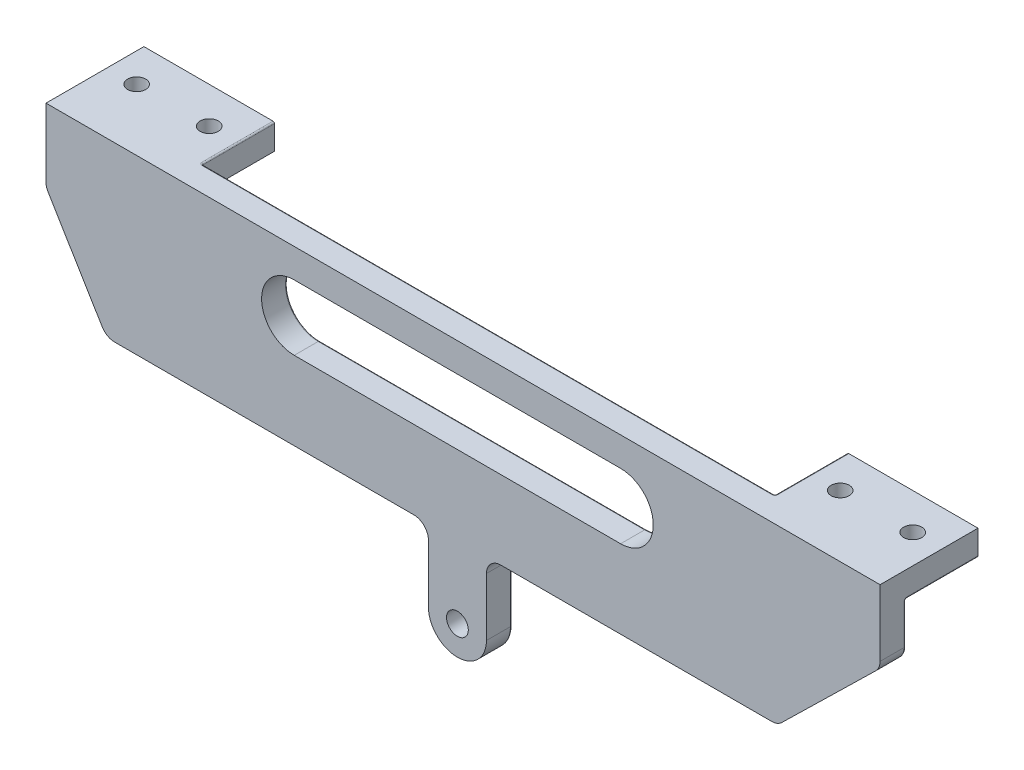
from build123d import *

# Parameters (mm, degrees)
SKETCH5_R           = 1.5
BOSS_EXTRUDE1_DEPTH = 3.5
SKETCH6_W           = 18
SKETCH6_H           = 10
SKETCH6_R           = 1.25
BOSS_EXTRUDE2_DEPTH = 3.5
FILLET1_R           = 2
FILLET2_R           = 0.2


with BuildPart() as part:
    # Sketch5 → Boss-Extrude1 (new body)
    with BuildSketch(Plane.XY):
        with BuildLine():
            Line((52.244364221, 93.802541786), (-62.755635779, 93.802541786))
            Line((-62.755635779, 93.802541786), (-62.755635779, 83.802541786))
            Line((-62.755635779, 83.802541786), (-54.423503372, 70))
            Line((-54.423503372, 70), (-10.03072393, 70))
            Line((-10.03072393, 70), (-10.03072393, 60))
            ThreePointArc((-10.03072393, 60), (-6.03072393, 56), (-2.03072393, 60))
            Line((-2.03072393, 60), (-2.03072393, 70))
            Line((-2.03072393, 70), (38.111411694, 70))
            Line((38.111411694, 70), (52.244364221, 83.802541786))
            Line((52.244364221, 83.802541786), (52.244364221, 93.802541786))
        make_face()
        with Locations((-6.03072393, 60)):
            Circle(SKETCH5_R, mode=Mode.SUBTRACT)
        with BuildLine():
            Line((16.46927607, 89.802541786), (-28.53072393, 89.802541786))
            ThreePointArc((-28.53072393, 89.802541786), (-33.03072393, 85.302541786), (-28.53072393, 80.802541786))
            Line((-28.53072393, 80.802541786), (16.46927607, 80.802541786))
            ThreePointArc((16.46927607, 80.802541786), (20.96927607, 85.302541786), (16.46927607, 89.802541786))
        make_face(mode=Mode.SUBTRACT)
    extrude(amount=BOSS_EXTRUDE1_DEPTH)

    # Sketch6 → Boss-Extrude2 (add)
    # profile 1 of 2: a face of its own
    with BuildSketch(Plane(origin=(0, 93.802541786, 0), x_dir=(1, 0, 0), z_dir=(0, 1, 0))):
        with Locations((-53.755635779, 5)):
            Rectangle(SKETCH6_W, SKETCH6_H)
        with Locations(Location((-58.755635779, 5, 0), (0, 0, 180))):
            Circle(SKETCH6_R, mode=Mode.SUBTRACT)
        with Locations(Location((-48.755635779, 5, 0), (0, 0, 180))):
            Circle(SKETCH6_R, mode=Mode.SUBTRACT)
    # profile 2 of 2: a face of its own
    with BuildSketch(Plane(origin=(0, 93.802541786, 0), x_dir=(1, 0, 0), z_dir=(0, 1, 0))):
        with Locations((43.244364221, 5)):
            Rectangle(SKETCH6_W, SKETCH6_H)
        with Locations((38.244364221, 5)):
            Circle(SKETCH6_R, mode=Mode.SUBTRACT)
        with Locations((48.244364221, 5)):
            Circle(SKETCH6_R, mode=Mode.SUBTRACT)
    extrude(amount=-BOSS_EXTRUDE2_DEPTH)

    # Fillet1
    fillet1_edges = [part.edges().sort_by_distance(p)[0] for p in [
        (52.244364221, 83.802541786, 1.75),
        (38.111411694, 70, 1.75),
        (-2.03072393, 70, 1.75),
        (-10.03072393, 70, 1.75),
        (-54.423503372, 70, 1.75),
        (-62.755635779, 83.802541786, 1.75),
    ]]
    fillet(fillet1_edges, radius=FILLET1_R)

    # Fillet2
    fillet2_edges = [part.edges().sort_by_distance(p)[0] for p in [
        (-2.03072393, 64, 0),
        (-6.03072393, 56, 0),
        (-7.53072393, 60, 0),
        (-33.03072393, 85.302541786, 0),
        (-6.03072393, 80.802541786, 0),
        (20.96927607, 85.302541786, 0),
        (-6.03072393, 89.802541786, 0),
        (-62.755635779, 87.330975349, 0),
        (-62.755635779, 90.302541786, -5),
        (-53.755635779, 90.302541786, 0),
        (-44.755635779, 92.052541786, 0),
        (-44.755635779, 93.802541786, -5),
        (-5.255635779, 93.802541786, 0),
        (52.244364221, 90.302541786, -5),
        (43.244364221, 90.302541786, 0),
        (34.244364221, 92.052541786, 0),
        (34.244364221, 93.802541786, -5),
        (-10.03072393, 64, 0),
        (-32.662699153, 70, 0),
        (18.633041615, 70, 0),
        (52.244364221, 87.473700585, 0),
        (45.167974716, 76.891589411, 0),
        (-58.737365074, 77.146100601, 0),
        (-62.682345408, 83.822948285, 0),
        (-54.277728874, 70.258275609, 0),
        (38.051233908, 70.147747242, 0),
        (52.087564977, 83.868579168, 0),
        (-10.616510367, 69.414213562, 0),
        (-1.444937492, 69.414213562, 0),
    ]]
    fillet(fillet2_edges, radius=FILLET2_R)


solid = part.part
